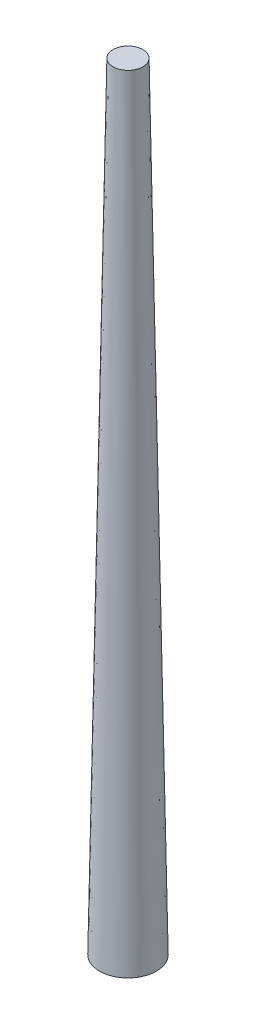
from build123d import *


with BuildPart() as part:
    # Szkic1 → Obrót1 (revolve)
    with BuildSketch(Plane.XY):
        Polygon((0, 78), (0, 0), (-2.861495064, 0), (-1.5, 78), align=None)
        Polygon((-2.861495064, 0), (0, 0), (0, 78), (-1.5, 78), align=None)
    revolve(axis=Axis((0, 78, 0), (0, -1, 0)))


solid = part.part
